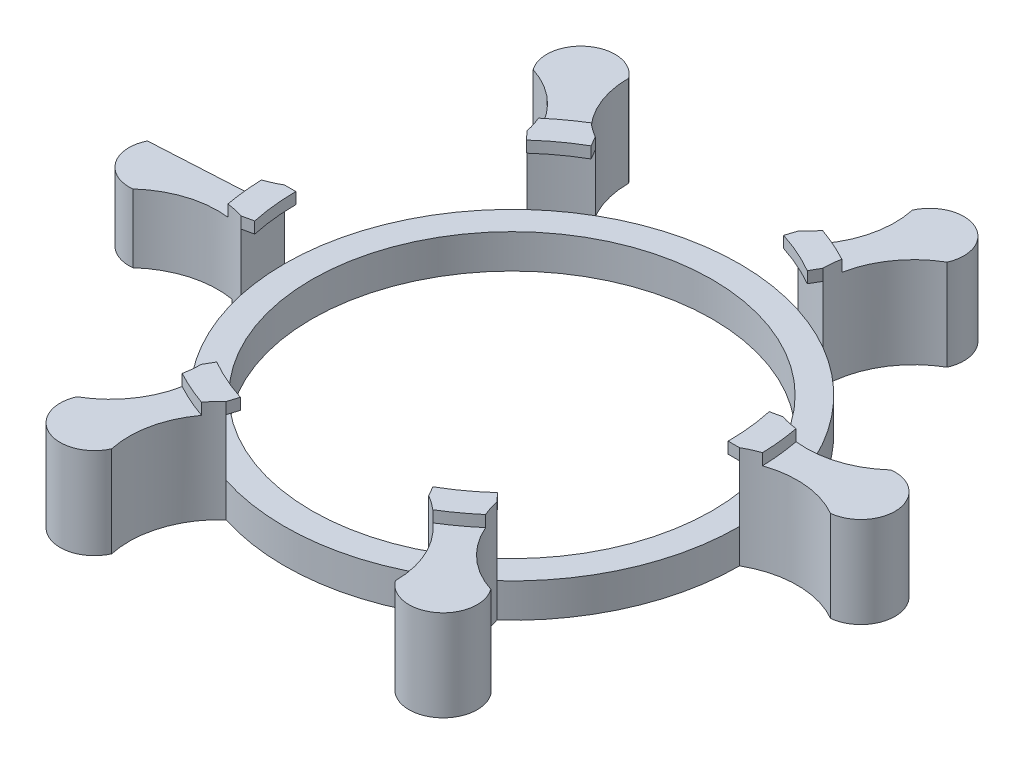
from build123d import *

# Parameters (mm, degrees)
SKETCH1_R                = 63.5
SKETCH1_R_2              = 55.88
BOSS_EXTRUDE1_DEPTH      = 9.525
BOSS_EXTRUDE2_DEPTH      = 15.875
BOSS_EXTRUDE2_DEPTH_BACK = 9.525
BOSS_EXTRUDE3_DEPTH      = 3.175
CIRPATTERN1_COUNT        = 6
BOSS_EXTRUDE7_DEPTH      = 9.525
CUT_EXTRUDE5_DEPTH       = 6.35
CUT_EXTRUDE8_START       = -15.875
CUT_EXTRUDE8_DEPTH       = 15.875
CUT_EXTRUDE10_DEPTH      = 10.414


with BuildPart() as part:
    # Sketch1 → Boss-Extrude1 (new body)
    with BuildSketch(Plane(origin=(0, 0, 0), x_dir=(1, 0, 0), z_dir=(0, 1, 0))):
        with Locations(Location((0, 0, 0), (0, 0, 90))):
            Circle(SKETCH1_R)
        with Locations(Location((0, 0, 0), (0, 0, 90))):
            Circle(SKETCH1_R_2, mode=Mode.SUBTRACT)
    extrude(amount=BOSS_EXTRUDE1_DEPTH)

    # Sketch2 → Boss-Extrude2 (add, two sides: drawn at the far end of the back side and taken through both)
    with BuildSketch(Plane(origin=(0, 9.525, 0), x_dir=(1, 0, 0), z_dir=(0, 1, 0)).offset(-BOSS_EXTRUDE2_DEPTH_BACK)):
        with BuildLine():
            ThreePointArc((62.042091837, 13.528815193), (75.175517225, 12.909752551), (86.858928571, 18.94034127))
            ThreePointArc((86.858928571, 18.94034127), (97.349634921, 10.490706349), (88.9, 0))
            ThreePointArc((88.9, 0), (76.2, 3.402954744), (63.5, 0))
            ThreePointArc((63.5, 0), (63.1344709, 6.803571429), (62.042091837, 13.528815193))
        make_face()
    extrude(amount=BOSS_EXTRUDE2_DEPTH + BOSS_EXTRUDE2_DEPTH_BACK)

    # Sketch3 → Boss-Extrude3 (add)
    with BuildSketch(Plane(origin=(0, 25.4, 0), x_dir=(1, 0, 0), z_dir=(0, 1, 0))):
        with BuildLine():
            Line((60.325, 0), (63.5, 0))
            ThreePointArc((63.5, 0), (65.659371798, 1.11258817), (67.915149907, 2.013811849))
            ThreePointArc((67.915149907, 2.013811849), (67.553883863, 7.279821429), (66.784920566, 12.501896255))
            ThreePointArc((66.784920566, 12.501896255), (64.388925587, 12.901830068), (62.042091837, 13.528815193))
            Line((62.042091837, 13.528815193), (58.939987245, 12.852374433))
            ThreePointArc((58.939987245, 12.852374433), (59.977747355, 6.463392857), (60.325, 0))
        make_face()
    extrude(amount=BOSS_EXTRUDE3_DEPTH)


with BuildPart() as cirpattern1_1:
    # CirPattern1: pattern copy
    add(part.part.rotate(Axis((0, 0, 0), (0, 1, 0)), 1 * 360 / CIRPATTERN1_COUNT))


with BuildPart() as cirpattern1_2:
    # CirPattern1: pattern copy
    add(part.part.rotate(Axis((0, 0, 0), (0, 1, 0)), 2 * 360 / CIRPATTERN1_COUNT))


with BuildPart() as cirpattern1_3:
    # CirPattern1: pattern copy
    add(part.part.rotate(Axis((0, 0, 0), (0, 1, 0)), 3 * 360 / CIRPATTERN1_COUNT))


with BuildPart() as cirpattern1_4:
    # CirPattern1: pattern copy
    add(part.part.rotate(Axis((0, 0, 0), (0, 1, 0)), 4 * 360 / CIRPATTERN1_COUNT))


with BuildPart() as cirpattern1_5:
    # CirPattern1: pattern copy
    add(part.part.rotate(Axis((0, 0, 0), (0, 1, 0)), 5 * 360 / CIRPATTERN1_COUNT))


with BuildPart() as part_1:
    add(part.part)

    add(cirpattern1_1.part)  # Boss-Extrude7 merges CirPattern1_1

    add(cirpattern1_2.part)  # Boss-Extrude7 merges CirPattern1_2

    add(cirpattern1_3.part)  # Boss-Extrude7 merges CirPattern1_3

    add(cirpattern1_4.part)  # Boss-Extrude7 merges CirPattern1_4

    add(cirpattern1_5.part)  # Boss-Extrude7 merges CirPattern1_5
    # Sketch7 → Boss-Extrude7 (add)
    with BuildSketch(Plane(origin=(0, 0, 0), x_dir=(-1, 0, 0), z_dir=(0, -1, 0))):
        with BuildLine():
            Line((63.5, 0), (67.569096786, -7.577162194))
            Line((67.569096786, -7.577162194), (97.349634921, -10.490706349))
            ThreePointArc((97.349634921, -10.490706349), (97.772251641, -5.252918049), (97.91325926, 0))
            Line((97.91325926, 0), (88.9, 0))
            Line((88.9, 0), (63.5, 0))
        make_face()
    extrude(amount=-BOSS_EXTRUDE7_DEPTH)

    # Sketch9 → Cut-Extrude5 (cut)
    with BuildSketch(Plane(origin=(0, 0, 0), x_dir=(-1, 0, 0), z_dir=(0, -1, 0))):
        with BuildLine():
            Line((61.39651055, -26.00046379), (106.955649778, -39.531378336))
            Line((106.955649778, -39.531378336), (132.962005417, 11.016778764))
            Line((132.962005417, 11.016778764), (94.714323946, 43.842731985))
            Line((94.714323946, 43.842731985), (63.332617029, 20.845508994))
            ThreePointArc((63.332617029, 20.845508994), (66.618128975, -2.753273836), (61.39651055, -26.00046379))
        make_face()
    extrude(amount=-CUT_EXTRUDE5_DEPTH, mode=Mode.SUBTRACT)

    # Sketch11 → Cut-Extrude8 (cut)
    with BuildSketch(Plane(origin=(0, 25.4, 0), x_dir=(1, 0, 0), z_dir=(0, 1, 0)).offset(CUT_EXTRUDE8_START)):
        with BuildLine():
            Line((-67.842452842, -3.731570369), (-122.840055189, -6.75662938))
            Line((-122.840055189, -6.75662938), (-98.142005423, 22.287709704))
            Line((-98.142005423, 22.287709704), (-66.460403185, 14.125786119))
            ThreePointArc((-66.460403185, 14.125786119), (-67.742420826, 5.242847087), (-67.842452842, -3.731570369))
        make_face()
    extrude(amount=CUT_EXTRUDE8_DEPTH, mode=Mode.SUBTRACT)

    # Sketch12 → Cut-Extrude10 (cut)
    with BuildSketch(Plane.XZ.offset(-6.35)):
        with BuildLine():
            Line((-69.200337384, 1.380715925), (-95.001475013, 1.380715925))
            ThreePointArc((-95.001475013, 1.380715925), (-96.144492419, 2.523733331), (-95.001475013, 3.666750736))
            Line((-95.001475013, 3.666750736), (-69.200337384, 3.666750736))
            ThreePointArc((-69.200337384, 3.666750736), (-68.057319979, 2.523733331), (-69.200337384, 1.380715925))
        make_face()
    extrude(amount=-CUT_EXTRUDE10_DEPTH, mode=Mode.SUBTRACT)


solid = part_1.part
